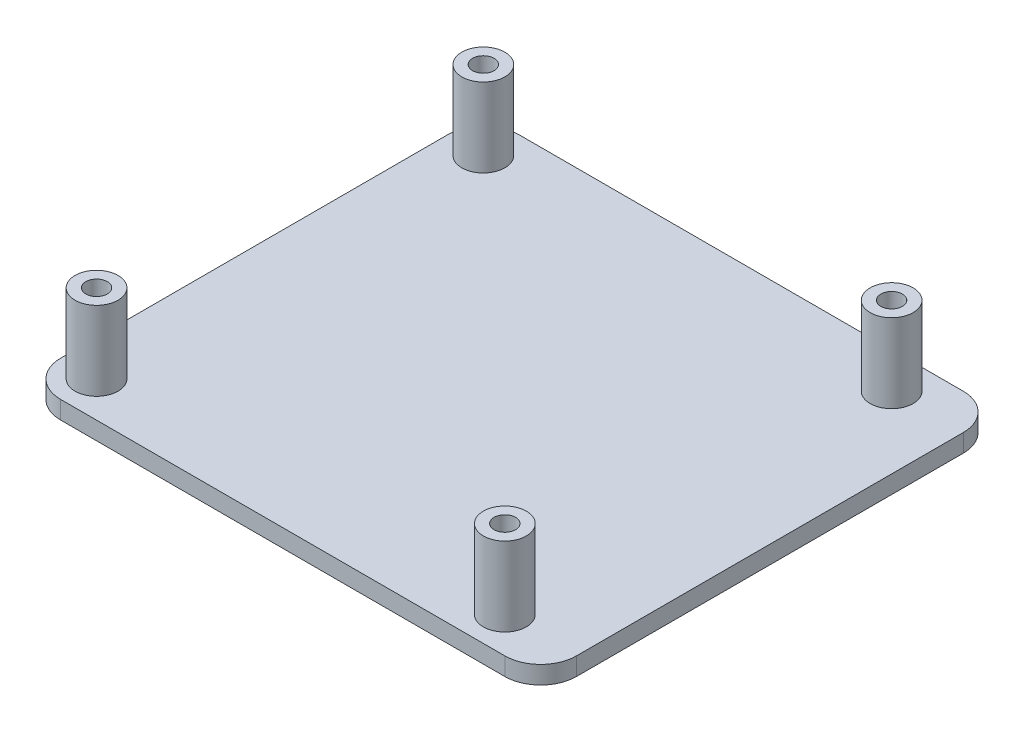
from build123d import *

# Parameters (mm, degrees)
SKETCH1_W               = 72
SKETCH1_H               = 64
BOSS_EXTRUDE1_DEPTH     = 2.5
SKETCH2_R               = 3
BOSS_EXTRUDE2_DEPTH     = 11
CUT_EXTRUDE1_DEPTH      = 51.02249494
CUT_EXTRUDE1_DEPTH_BACK = 51.02249494
SKETCH3_R               = 1.5
FILLET1_R               = 5


with BuildPart() as part:
    # Sketch1 → Boss-Extrude1 (new body)
    with BuildSketch(Plane(origin=(0, 0, 0), x_dir=(1, 0, 0), z_dir=(0, 1, 0))):
        Rectangle(SKETCH1_W, SKETCH1_H)
    extrude(amount=BOSS_EXTRUDE1_DEPTH)

    # Sketch2 → Boss-Extrude2 (add)
    with BuildSketch(Plane(origin=(0, 2.5, 0), x_dir=(1, 0, 0), z_dir=(0, 1, 0))):
        with Locations(Location((-31, 27, 0), (0, 0, 270))):
            Circle(SKETCH2_R)
        with Locations(Location((26, 27, 0), (0, 0, 270))):
            Circle(SKETCH2_R)
        with Locations(Location((-31, -27, 0), (0, 0, 270))):
            Circle(SKETCH2_R)
        with Locations(Location((26, -27, 0), (0, 0, 270))):
            Circle(SKETCH2_R)
    extrude(amount=BOSS_EXTRUDE2_DEPTH)

    # Sketch3 → Cut-Extrude1 (cut, two sides: drawn at the far end of the back side and taken through both)
    with BuildSketch(Plane(origin=(0, 13.5, 0), x_dir=(1, 0, 0), z_dir=(0, 1, 0)).offset(-CUT_EXTRUDE1_DEPTH_BACK)):
        with Locations(Location((-31, 27, 0), (0, 0, 270))):
            Circle(SKETCH3_R)
        with Locations(Location((-31, -27, 0), (0, 0, 270))):
            Circle(SKETCH3_R)
        with Locations(Location((26, 27, 0), (0, 0, 270))):
            Circle(SKETCH3_R)
        with Locations(Location((26, -27, 0), (0, 0, 270))):
            Circle(SKETCH3_R)
    extrude(amount=CUT_EXTRUDE1_DEPTH + CUT_EXTRUDE1_DEPTH_BACK, mode=Mode.SUBTRACT)

    # Fillet1
    fillet1_edges = [part.edges().sort_by_distance(p)[0] for p in [
        (-36, 1.25, -32),
        (36, 1.25, -32),
        (36, 1.25, 32),
        (-36, 1.25, 32),
    ]]
    fillet(fillet1_edges, radius=FILLET1_R)


solid = part.part
